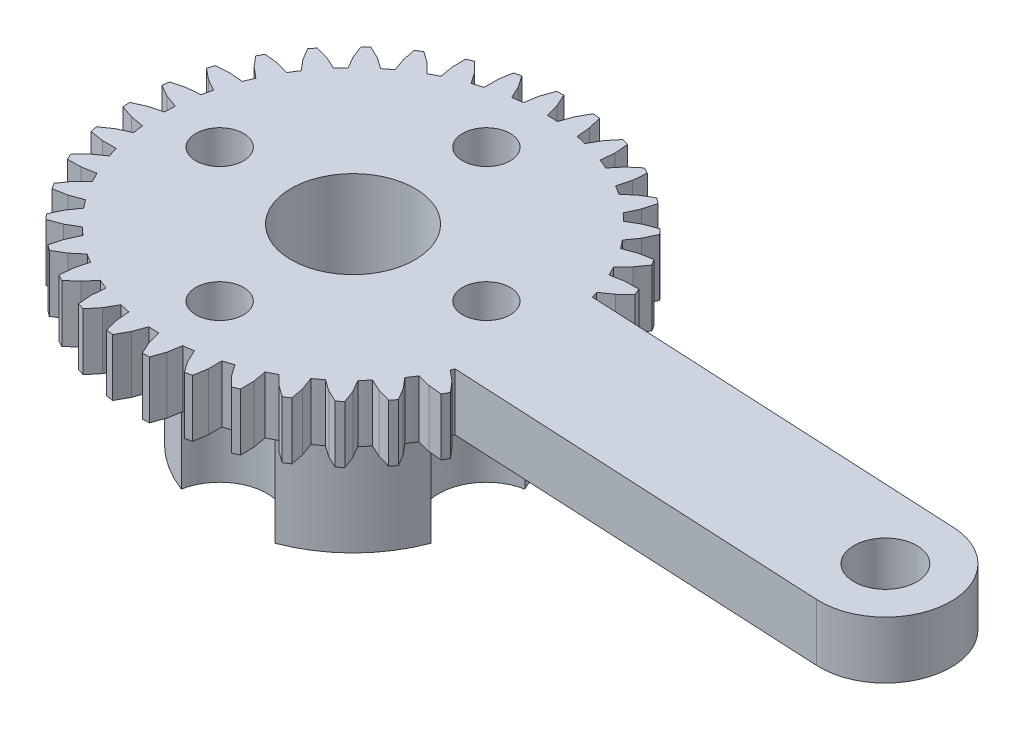
from build123d import *

# Parameters (mm, degrees)
SKETCH_1_R               = 1.65
EXTRUDE_1_DEPTH          = 3
EXTRUDE_START            = 7
SKETCH_4_R               = 7
SKETCH_4_R_2             = 1.65
EXTRUDE_3_DEPTH          = 7
CUT_EXTRUDE_1_DEPTH      = 10
CUT_EXTRUDE_1_DEPTH_BACK = 36.461823865
SKETCH_5_R               = 1.25
CUT_EXTRUDE_4_DEPTH      = 10
CUT_EXTRUDE_4_DEPTH_BACK = 0.5
SKETCH_8_R               = 2.5
SKETCH_9_R               = 3.25
CUT_EXTRUDE_5_DEPTH      = 5.5


with BuildPart() as part:
    # 草图1 → 凸台-拉伸1 (new body)
    with BuildSketch(Plane(origin=(0, 0, 0), x_dir=(1, 0, 0), z_dir=(0, 1, 0))):
        with BuildLine():
            Line((4.082652453, 9.182284571), (4.542193627, 9.733960118))
            Line((4.542193627, 9.733960118), (5.08677931, 10.201881516))
            Line((5.08677931, 10.201881516), (5.409142478, 10.034684243))
            Line((5.409142478, 10.034684243), (5.340349944, 9.319987393))
            Line((5.340349944, 9.319987393), (5.154106126, 8.626563107))
            ThreePointArc((5.154106126, 8.626563107), (5.386599243, 8.483333637), (5.615114771, 8.333839878))
            Line((5.615114771, 8.333839878), (6.163471936, 8.797335746))
            Line((6.163471936, 8.797335746), (6.781037836, 9.163582055))
            Line((6.781037836, 9.163582055), (7.069470082, 8.942947108))
            Line((7.069470082, 8.942947108), (6.877616855, 8.251053807))
            Line((6.877616855, 8.251053807), (6.573790635, 7.600505094))
            ThreePointArc((6.573790635, 7.600505094), (6.777880123, 7.419079595), (6.976964668, 7.232175677))
            Line((6.976964668, 7.232175677), (7.597476268, 7.593408779))
            Line((7.597476268, 7.593408779), (8.269257959, 7.84685179))
            Line((8.269257959, 7.84685179), (8.514995414, 7.57948305))
            Line((8.514995414, 7.57948305), (8.205910859, 6.931416126))
            Line((8.205910859, 6.931416126), (7.793733843, 6.343509579))
            ThreePointArc((7.793733843, 6.343509579), (7.963218546, 6.129400573), (8.126823025, 5.910765477))
            Line((8.126823025, 5.910765477), (8.800635129, 6.158759929))
            Line((8.800635129, 6.158759929), (9.506220864, 6.291698904))
            Line((9.506220864, 6.291698904), (9.70179692, 5.985720234))
            Line((9.70179692, 5.985720234), (9.284872413, 5.401170874))
            Line((9.284872413, 5.401170874), (8.776868392, 4.893769736))
            ThreePointArc((8.776868392, 4.893769736), (8.906598603, 4.653482817), (9.029751976, 4.40975966))
            Line((9.029751976, 4.40975966), (9.736391145, 4.536980274))
            Line((9.736391145, 4.536980274), (10.454342057, 4.545375931))
            Line((10.454342057, 4.545375931), (10.593814236, 4.210084339))
            Line((10.593814236, 4.210084339), (10.081717818, 3.706813777))
            Line((10.081717818, 3.706813777), (9.493322236, 3.295335175))
            ThreePointArc((9.493322236, 3.295335175), (9.549169851, 3.129817271), (9.602131873, 2.96335359))
            Line((9.602131873, 2.96335359), (29.577411172, 1.969262601))
            ThreePointArc((29.577411172, 1.969262601), (32.83929082, -1.634282185), (29.235746034, -4.896161833))
            Line((29.235746034, -4.896161833), (9.260466734, -3.902070843))
            ThreePointArc((9.260466734, -3.902070843), (9.221817682, -3.992553023), (9.182284571, -4.082652453))
            Line((9.182284571, -4.082652453), (9.733960118, -4.542193627))
            Line((9.733960118, -4.542193627), (10.201881516, -5.08677931))
            Line((10.201881516, -5.08677931), (10.034684243, -5.409142478))
            Line((10.034684243, -5.409142478), (9.319987393, -5.340349944))
            Line((9.319987393, -5.340349944), (8.626563107, -5.154106126))
            ThreePointArc((8.626563107, -5.154106126), (8.483333637, -5.386599243), (8.333839878, -5.615114771))
            Line((8.333839878, -5.615114771), (8.797335746, -6.163471936))
            Line((8.797335746, -6.163471936), (9.163582055, -6.781037836))
            Line((9.163582055, -6.781037836), (8.942947108, -7.069470082))
            Line((8.942947108, -7.069470082), (8.251053807, -6.877616855))
            Line((8.251053807, -6.877616855), (7.600505094, -6.573790635))
            ThreePointArc((7.600505094, -6.573790635), (7.419079595, -6.777880123), (7.232175677, -6.976964668))
            Line((7.232175677, -6.976964668), (7.593408779, -7.597476268))
            Line((7.593408779, -7.597476268), (7.84685179, -8.269257959))
            Line((7.84685179, -8.269257959), (7.57948305, -8.514995414))
            Line((7.57948305, -8.514995414), (6.931416126, -8.205910859))
            Line((6.931416126, -8.205910859), (6.343509579, -7.793733843))
            ThreePointArc((6.343509579, -7.793733843), (6.129400573, -7.963218546), (5.910765477, -8.126823025))
            Line((5.910765477, -8.126823025), (6.158759929, -8.800635129))
            Line((6.158759929, -8.800635129), (6.291698904, -9.506220864))
            Line((6.291698904, -9.506220864), (5.985720234, -9.70179692))
            Line((5.985720234, -9.70179692), (5.401170874, -9.284872413))
            Line((5.401170874, -9.284872413), (4.893769736, -8.776868392))
            ThreePointArc((4.893769736, -8.776868392), (4.653482817, -8.906598603), (4.40975966, -9.029751976))
            Line((4.40975966, -9.029751976), (4.536980274, -9.736391145))
            Line((4.536980274, -9.736391145), (4.545375931, -10.454342057))
            Line((4.545375931, -10.454342057), (4.210084339, -10.593814236))
            Line((4.210084339, -10.593814236), (3.706813777, -10.081717818))
            Line((3.706813777, -10.081717818), (3.295335175, -9.493322236))
            ThreePointArc((3.295335175, -9.493322236), (3.03617134, -9.579356168), (2.774765527, -9.658316482))
            Line((2.774765527, -9.658316482), (2.77734677, -10.376311842))
            Line((2.77734677, -10.376311842), (2.66094401, -11.084813358))
            Line((2.66094401, -11.084813358), (2.306527161, -11.163943867))
            Line((2.306527161, -11.163943867), (1.89982702, -10.572235328))
            Line((1.89982702, -10.572235328), (1.596773523, -9.921326288))
            ThreePointArc((1.596773523, -9.921326288), (1.326607334, -9.961049843), (1.055461547, -9.99341793))
            Line((1.055461547, -9.99341793), (0.933324989, -10.700953555))
            Line((0.933324989, -10.700953555), (0.695660652, -11.378478214))
            Line((0.695660652, -11.378478214), (0.332887323, -11.394862713))
            Line((0.332887323, -11.394862713), (0.03511498, -10.741520817))
            Line((0.03511498, -10.741520817), (-0.150305285, -10.047875861))
            ThreePointArc((-0.150305285, -10.047875861), (-0.423264966, -10.04008206), (-0.695912098, -10.024874431))
            Line((-0.695912098, -10.024874431), (-0.939055399, -10.70045221))
            Line((-0.939055399, -10.70045221), (-1.290760003, -11.326413767))
            Line((-1.290760003, -11.326413767), (-1.650867128, -11.279554421))
            Line((-1.650867128, -11.279554421), (-1.83066401, -10.584430632))
            Line((-1.83066401, -10.584430632), (-1.892817143, -9.869125811))
            ThreePointArc((-1.892817143, -9.869125811), (-2.160276573, -9.814051463), (-2.426140806, -9.751730195))
            Line((-2.426140806, -9.751730195), (-2.782903063, -10.374823038))
            Line((-2.782903063, -10.374823038), (-3.237961568, -10.930201969))
            Line((-3.237961568, -10.930201969), (-3.584460817, -10.821522576))
            Line((-3.584460817, -10.821522576), (-3.640819202, -10.105737879))
            Line((-3.640819202, -10.105737879), (-3.577816709, -9.390507366))
            ThreePointArc((-3.577816709, -9.390507366), (-3.83164927, -9.28982588), (-4.082652453, -9.182284571))
            Line((-4.082652453, -9.182284571), (-4.542193627, -9.733960118))
            Line((-4.542193627, -9.733960118), (-5.08677931, -10.201881516))
            Line((-5.08677931, -10.201881516), (-5.409142478, -10.034684243))
            Line((-5.409142478, -10.034684243), (-5.340349944, -9.319987393))
            Line((-5.340349944, -9.319987393), (-5.154106126, -8.626563107))
            ThreePointArc((-5.154106126, -8.626563107), (-5.386599243, -8.483333637), (-5.615114771, -8.333839878))
            Line((-5.615114771, -8.333839878), (-6.163471936, -8.797335746))
            Line((-6.163471936, -8.797335746), (-6.781037836, -9.163582055))
            Line((-6.781037836, -9.163582055), (-7.069470082, -8.942947108))
            Line((-7.069470082, -8.942947108), (-6.877616855, -8.251053807))
            Line((-6.877616855, -8.251053807), (-6.573790635, -7.600505094))
            ThreePointArc((-6.573790635, -7.600505094), (-6.777880123, -7.419079595), (-6.976964668, -7.232175677))
            Line((-6.976964668, -7.232175677), (-7.597476268, -7.593408779))
            Line((-7.597476268, -7.593408779), (-8.269257959, -7.84685179))
            Line((-8.269257959, -7.84685179), (-8.514995414, -7.57948305))
            Line((-8.514995414, -7.57948305), (-8.205910859, -6.931416126))
            Line((-8.205910859, -6.931416126), (-7.793733843, -6.343509579))
            ThreePointArc((-7.793733843, -6.343509579), (-7.963218546, -6.129400573), (-8.126823025, -5.910765477))
            Line((-8.126823025, -5.910765477), (-8.800635129, -6.158759929))
            Line((-8.800635129, -6.158759929), (-9.506220864, -6.291698904))
            Line((-9.506220864, -6.291698904), (-9.70179692, -5.985720234))
            Line((-9.70179692, -5.985720234), (-9.284872413, -5.401170874))
            Line((-9.284872413, -5.401170874), (-8.776868392, -4.893769736))
            ThreePointArc((-8.776868392, -4.893769736), (-8.906598603, -4.653482817), (-9.029751976, -4.40975966))
            Line((-9.029751976, -4.40975966), (-9.736391145, -4.536980274))
            Line((-9.736391145, -4.536980274), (-10.454342057, -4.545375931))
            Line((-10.454342057, -4.545375931), (-10.593814236, -4.210084339))
            Line((-10.593814236, -4.210084339), (-10.081717818, -3.706813777))
            Line((-10.081717818, -3.706813777), (-9.493322236, -3.295335175))
            ThreePointArc((-9.493322236, -3.295335175), (-9.579356168, -3.03617134), (-9.658316482, -2.774765527))
            Line((-9.658316482, -2.774765527), (-10.376311842, -2.77734677))
            Line((-10.376311842, -2.77734677), (-11.084813358, -2.66094401))
            Line((-11.084813358, -2.66094401), (-11.163943867, -2.306527161))
            Line((-11.163943867, -2.306527161), (-10.572235328, -1.89982702))
            Line((-10.572235328, -1.89982702), (-9.921326288, -1.596773523))
            ThreePointArc((-9.921326288, -1.596773523), (-9.961049843, -1.326607334), (-9.99341793, -1.055461547))
            Line((-9.99341793, -1.055461547), (-10.700953555, -0.933324989))
            Line((-10.700953555, -0.933324989), (-11.378478214, -0.695660652))
            Line((-11.378478214, -0.695660652), (-11.394862713, -0.332887323))
            Line((-11.394862713, -0.332887323), (-10.741520817, -0.03511498))
            Line((-10.741520817, -0.03511498), (-10.047875861, 0.150305285))
            ThreePointArc((-10.047875861, 0.150305285), (-10.04008206, 0.423264966), (-10.024874431, 0.695912098))
            Line((-10.024874431, 0.695912098), (-10.70045221, 0.939055399))
            Line((-10.70045221, 0.939055399), (-11.326413767, 1.290760003))
            Line((-11.326413767, 1.290760003), (-11.279554421, 1.650867128))
            Line((-11.279554421, 1.650867128), (-10.584430632, 1.83066401))
            Line((-10.584430632, 1.83066401), (-9.869125811, 1.892817143))
            ThreePointArc((-9.869125811, 1.892817143), (-9.814051463, 2.160276573), (-9.751730195, 2.426140806))
            Line((-9.751730195, 2.426140806), (-10.374823038, 2.782903063))
            Line((-10.374823038, 2.782903063), (-10.930201969, 3.237961568))
            Line((-10.930201969, 3.237961568), (-10.821522576, 3.584460817))
            Line((-10.821522576, 3.584460817), (-10.105737879, 3.640819202))
            Line((-10.105737879, 3.640819202), (-9.390507366, 3.577816709))
            ThreePointArc((-9.390507366, 3.577816709), (-9.28982588, 3.83164927), (-9.182284571, 4.082652453))
            Line((-9.182284571, 4.082652453), (-9.733960118, 4.542193627))
            Line((-9.733960118, 4.542193627), (-10.201881516, 5.08677931))
            Line((-10.201881516, 5.08677931), (-10.034684243, 5.409142478))
            Line((-10.034684243, 5.409142478), (-9.319987393, 5.340349944))
            Line((-9.319987393, 5.340349944), (-8.626563107, 5.154106126))
            ThreePointArc((-8.626563107, 5.154106126), (-8.483333637, 5.386599243), (-8.333839878, 5.615114771))
            Line((-8.333839878, 5.615114771), (-8.797335746, 6.163471936))
            Line((-8.797335746, 6.163471936), (-9.163582055, 6.781037836))
            Line((-9.163582055, 6.781037836), (-8.942947108, 7.069470082))
            Line((-8.942947108, 7.069470082), (-8.251053807, 6.877616855))
            Line((-8.251053807, 6.877616855), (-7.600505094, 6.573790635))
            ThreePointArc((-7.600505094, 6.573790635), (-7.419079595, 6.777880123), (-7.232175677, 6.976964668))
            Line((-7.232175677, 6.976964668), (-7.593408779, 7.597476268))
            Line((-7.593408779, 7.597476268), (-7.84685179, 8.269257959))
            Line((-7.84685179, 8.269257959), (-7.57948305, 8.514995414))
            Line((-7.57948305, 8.514995414), (-6.931416126, 8.205910859))
            Line((-6.931416126, 8.205910859), (-6.343509579, 7.793733843))
            ThreePointArc((-6.343509579, 7.793733843), (-6.129400573, 7.963218546), (-5.910765477, 8.126823025))
            Line((-5.910765477, 8.126823025), (-6.158759929, 8.800635129))
            Line((-6.158759929, 8.800635129), (-6.291698904, 9.506220864))
            Line((-6.291698904, 9.506220864), (-5.985720234, 9.70179692))
            Line((-5.985720234, 9.70179692), (-5.401170874, 9.284872413))
            Line((-5.401170874, 9.284872413), (-4.893769736, 8.776868392))
            ThreePointArc((-4.893769736, 8.776868392), (-4.653482817, 8.906598603), (-4.40975966, 9.029751976))
            Line((-4.40975966, 9.029751976), (-4.536980274, 9.736391145))
            Line((-4.536980274, 9.736391145), (-4.545375931, 10.454342057))
            Line((-4.545375931, 10.454342057), (-4.210084339, 10.593814236))
            Line((-4.210084339, 10.593814236), (-3.706813777, 10.081717818))
            Line((-3.706813777, 10.081717818), (-3.295335175, 9.493322236))
            ThreePointArc((-3.295335175, 9.493322236), (-3.03617134, 9.579356168), (-2.774765527, 9.658316482))
            Line((-2.774765527, 9.658316482), (-2.77734677, 10.376311842))
            Line((-2.77734677, 10.376311842), (-2.66094401, 11.084813358))
            Line((-2.66094401, 11.084813358), (-2.306527161, 11.163943867))
            Line((-2.306527161, 11.163943867), (-1.89982702, 10.572235328))
            Line((-1.89982702, 10.572235328), (-1.596773523, 9.921326288))
            ThreePointArc((-1.596773523, 9.921326288), (-1.326607334, 9.961049843), (-1.055461547, 9.99341793))
            Line((-1.055461547, 9.99341793), (-0.933324989, 10.700953555))
            Line((-0.933324989, 10.700953555), (-0.695660652, 11.378478214))
            Line((-0.695660652, 11.378478214), (-0.332887323, 11.394862713))
            Line((-0.332887323, 11.394862713), (-0.03511498, 10.741520817))
            Line((-0.03511498, 10.741520817), (0.150305285, 10.047875861))
            ThreePointArc((0.150305285, 10.047875861), (0.423264966, 10.04008206), (0.695912098, 10.024874431))
            Line((0.695912098, 10.024874431), (0.939055399, 10.70045221))
            Line((0.939055399, 10.70045221), (1.290760003, 11.326413767))
            Line((1.290760003, 11.326413767), (1.650867128, 11.279554421))
            Line((1.650867128, 11.279554421), (1.83066401, 10.584430632))
            Line((1.83066401, 10.584430632), (1.892817143, 9.869125811))
            ThreePointArc((1.892817143, 9.869125811), (2.160276573, 9.814051463), (2.426140806, 9.751730195))
            Line((2.426140806, 9.751730195), (2.782903063, 10.374823038))
            Line((2.782903063, 10.374823038), (3.237961568, 10.930201969))
            Line((3.237961568, 10.930201969), (3.584460817, 10.821522576))
            Line((3.584460817, 10.821522576), (3.640819202, 10.105737879))
            Line((3.640819202, 10.105737879), (3.577816709, 9.390507366))
            ThreePointArc((3.577816709, 9.390507366), (3.83164927, 9.28982588), (4.082652453, 9.182284571))
        make_face()
        with Locations((29.406578603, -1.463449616)):
            Circle(SKETCH_1_R, mode=Mode.SUBTRACT)
        Circle(SKETCH_1_R, mode=Mode.SUBTRACT)
    extrude(amount=EXTRUDE_1_DEPTH)

    # 草图4 → 凸台-拉伸3 (add)
    with BuildSketch(Plane.XZ.offset(EXTRUDE_START)):
        Circle(SKETCH_4_R)
        Circle(SKETCH_4_R_2, mode=Mode.SUBTRACT)
    extrude(amount=-EXTRUDE_3_DEPTH)

    # 草图5 → 切除-拉伸1 (cut, two sides: drawn at the far end of the back side and taken through both)
    with BuildSketch(Plane.XZ.offset(-CUT_EXTRUDE_1_DEPTH_BACK)):
        with Locations((7, 0)):
            Circle(SKETCH_5_R)
        with Locations((0, -7)):
            Circle(SKETCH_5_R)
        with Locations((-7, 0)):
            Circle(SKETCH_5_R)
        with Locations((0, 7)):
            Circle(SKETCH_5_R)
    extrude(amount=CUT_EXTRUDE_1_DEPTH + CUT_EXTRUDE_1_DEPTH_BACK, mode=Mode.SUBTRACT)

    # 草图8 → 切除-拉伸4 (cut, two sides: drawn at the far end of the back side and taken through both)
    with BuildSketch(Plane.XZ.offset(-CUT_EXTRUDE_4_DEPTH_BACK)):
        with Locations((0, 7)):
            Circle(SKETCH_8_R)
        with Locations((7, 0)):
            Circle(SKETCH_8_R)
        with Locations((0, -7)):
            Circle(SKETCH_8_R)
        with Locations((-7, 0)):
            Circle(SKETCH_8_R)
    extrude(amount=CUT_EXTRUDE_4_DEPTH + CUT_EXTRUDE_4_DEPTH_BACK, mode=Mode.SUBTRACT)

    # 草图9 → 切除-拉伸5 (cut)
    with BuildSketch(Plane(origin=(0, 3, 0), x_dir=(1, 0, 0), z_dir=(0, 1, 0))):
        Circle(SKETCH_9_R)
    extrude(amount=-CUT_EXTRUDE_5_DEPTH, mode=Mode.SUBTRACT)


solid = part.part
